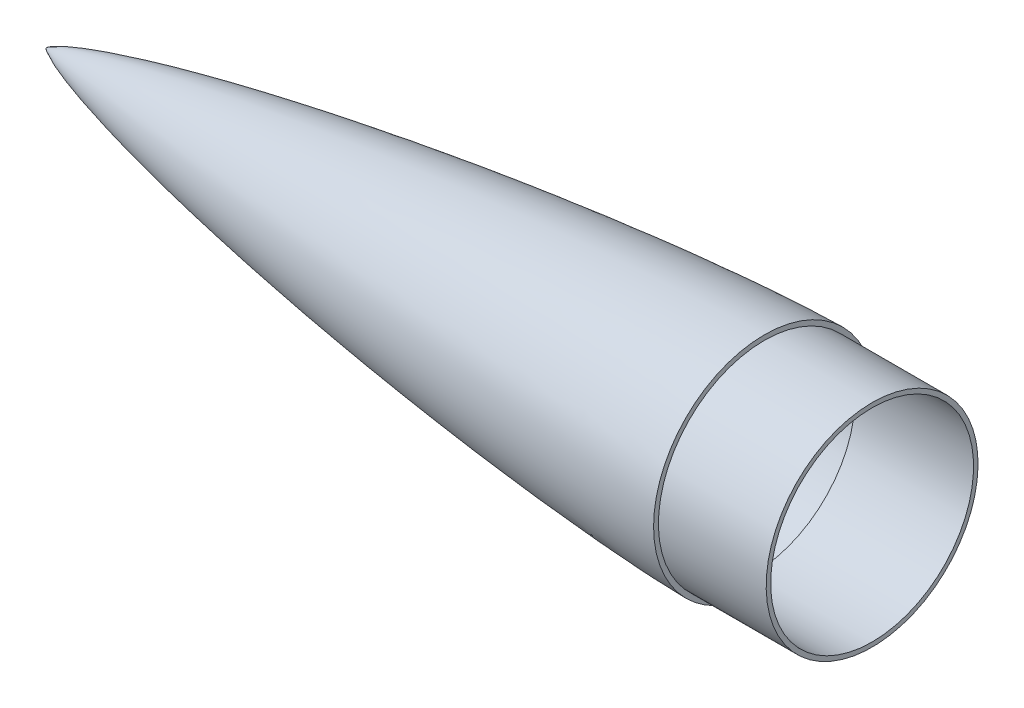
from build123d import *


with BuildPart() as part:
    # Sketch8 → Revolve8 (revolve)
    with BuildSketch(Plane.XY):
        with BuildLine():
            Line((500.38, 74.93), (500.38, 71.755))
            Line((500.38, 71.755), (584.2, 71.755))
            Line((584.2, 71.755), (584.2, 74.93))
            Line((584.2, 74.93), (508, 74.93))
            Line((508, 74.93), (508, 78.359))
            add(Edge.make_bspline(
                [(0, 0), (0.002822011, 0.011220682), (0.01010376, 0.033028979), (0.031502321, 0.074017024), (0.069784833, 0.131646678), (0.119222388, 0.195375451), (0.189812425, 0.276067496), (0.274835356, 0.363880791), (0.401947452, 0.484306453), (0.602624186, 0.656685654), (0.914446886, 0.898448081), (1.444794417, 1.267055392), (2.342189308, 1.821854316), (3.926219982, 2.68636524), (6.792153336, 4.05339861), (11.891147147, 6.162529219), (20.431057711, 9.216107653), (31.891623295, 12.776951203), (45.625686568, 16.59500746), (64.715206078, 21.439103902), (87.842839522, 26.755548696), (115.260857413, 32.475768916), (146.98211669, 38.485522007), (178.789638074, 44.017933119), (210.666331669, 49.135593448), (242.60094075, 53.877496918), (274.585932559, 58.26635678), (306.615943821, 62.313330004), (338.687218842, 66.019317565), (370.797101622, 69.374815155), (402.943853119, 72.357821551), (431.103668314, 74.606208089), (455.262955994, 76.229190957), (474.443672775, 77.278006717), (487.103143355, 77.83586579), (497.267203511, 78.174386426), (503.399758723, 78.310011701), (506.466506539, 78.353386553), (508, 78.359)],
                knots=[0, 0, 0, 0, 0, 8.9262e-05, 0.000178524, 0.000357048, 0.000535573, 0.000714097, 0.001009141, 0.001304186, 0.001892408, 0.002763912, 0.00406622, 0.006308364, 0.010066681, 0.016745451, 0.028667746, 0.049062689, 0.080343506, 0.109747473, 0.13915144, 0.201713099, 0.264274768, 0.326836438, 0.389398105, 0.451959776, 0.514521446, 0.577083113, 0.639644785, 0.702206453, 0.764768123, 0.827329793, 0.889891462, 0.921172297, 0.952453131, 0.976226566, 0.988113283, 1, 1, 1, 1, 1], degree=4))
            Line((0, 0), (6.35, 0))
            add(Edge.make_bspline(
                [(6.35, 0), (8.889966248, 0.941776103), (14.002430312, 2.70221944), (24.41368228, 5.964971946), (37.574073752, 9.665921605), (53.501991859, 13.736026967), (74.851541203, 18.791009134), (101.687004562, 24.566899435), (134.032795497, 30.880258005), (166.481591208, 36.697147411), (209.851744403, 43.889291933), (264.223227055, 51.942055028), (329.654722932, 60.283647017), (384.307447224, 66.144658428), (428.093023224, 70.10279457), (460.962543932, 72.656167083), (485.06167469, 74.168475737), (498.205122142, 74.826200882), (500.38, 74.93)],
                knots=[0.027271759, 0.027271759, 0.027271759, 0.027271759, 0.042372952, 0.057474145, 0.087676531, 0.117878917, 0.148081302, 0.208486074, 0.268890845, 0.329295617, 0.389700388, 0.510509931, 0.631319474, 0.752129017, 0.812533788, 0.87293856, 0.933343331, 0.945322529, 0.945322529, 0.945322529, 0.945322529], degree=3))
        make_face()
    revolve(axis=Axis((508, 0, 0), (-1, 0, 0)))


solid = part.part
